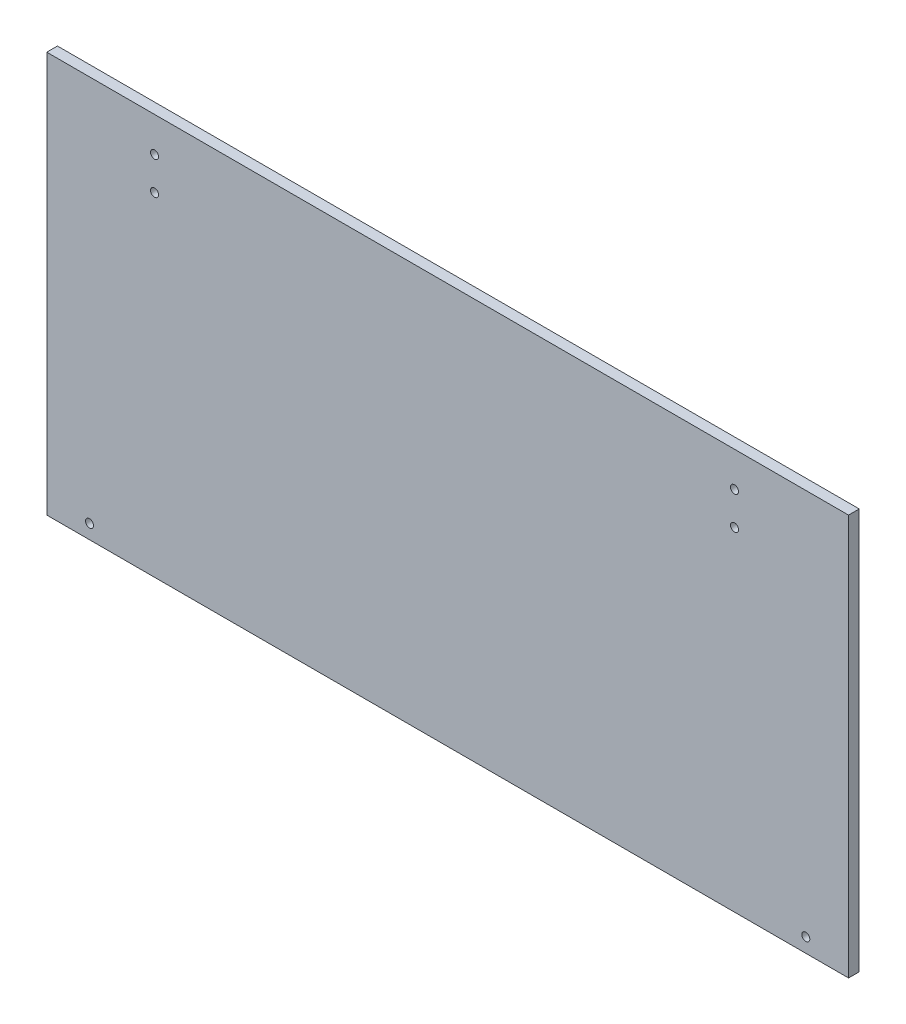
from build123d import *

# Parameters (mm, degrees)
SCHIZZO1_W                   = 450
SCHIZZO1_H                   = 225
ESTRUSIONE_ESTRUSIONE1_DEPTH = 6
SCHIZZO2_R                   = 2.25
TAGLIO_ESTRUSIONE1_DEPTH     = 10
SCHIZZO3_R                   = 2.25
TAGLIO_ESTRUSIONE2_DEPTH     = 10


with BuildPart() as part:
    # Schizzo1 → Estrusione-Estrusione1 (new body)
    with BuildSketch(Plane.XY):
        Rectangle(SCHIZZO1_W, SCHIZZO1_H)
    extrude(amount=ESTRUSIONE_ESTRUSIONE1_DEPTH)

    # Schizzo2 → Taglio-Estrusione1 (cut)
    with BuildSketch(Plane(origin=(0, 0, 0), x_dir=(-1, 0, 0), z_dir=(0, 0, -1))):
        with Locations((-161, 93)):
            Circle(SCHIZZO2_R)
        with Locations((-161, 74.5)):
            Circle(SCHIZZO2_R)
        with Locations((164.5, 93)):
            Circle(SCHIZZO2_R)
        with Locations((164.5, 74.5)):
            Circle(SCHIZZO2_R)
    extrude(amount=-TAGLIO_ESTRUSIONE1_DEPTH, mode=Mode.SUBTRACT)

    # Schizzo3 → Taglio-Estrusione2 (cut)
    with BuildSketch(Plane(origin=(0, 0, 0), x_dir=(-1, 0, 0), z_dir=(0, 0, -1))):
        with Locations((201, -104.5)):
            Circle(SCHIZZO3_R)
        with Locations((-201, -104.5)):
            Circle(SCHIZZO3_R)
    extrude(amount=-TAGLIO_ESTRUSIONE2_DEPTH, mode=Mode.SUBTRACT)


solid = part.part
